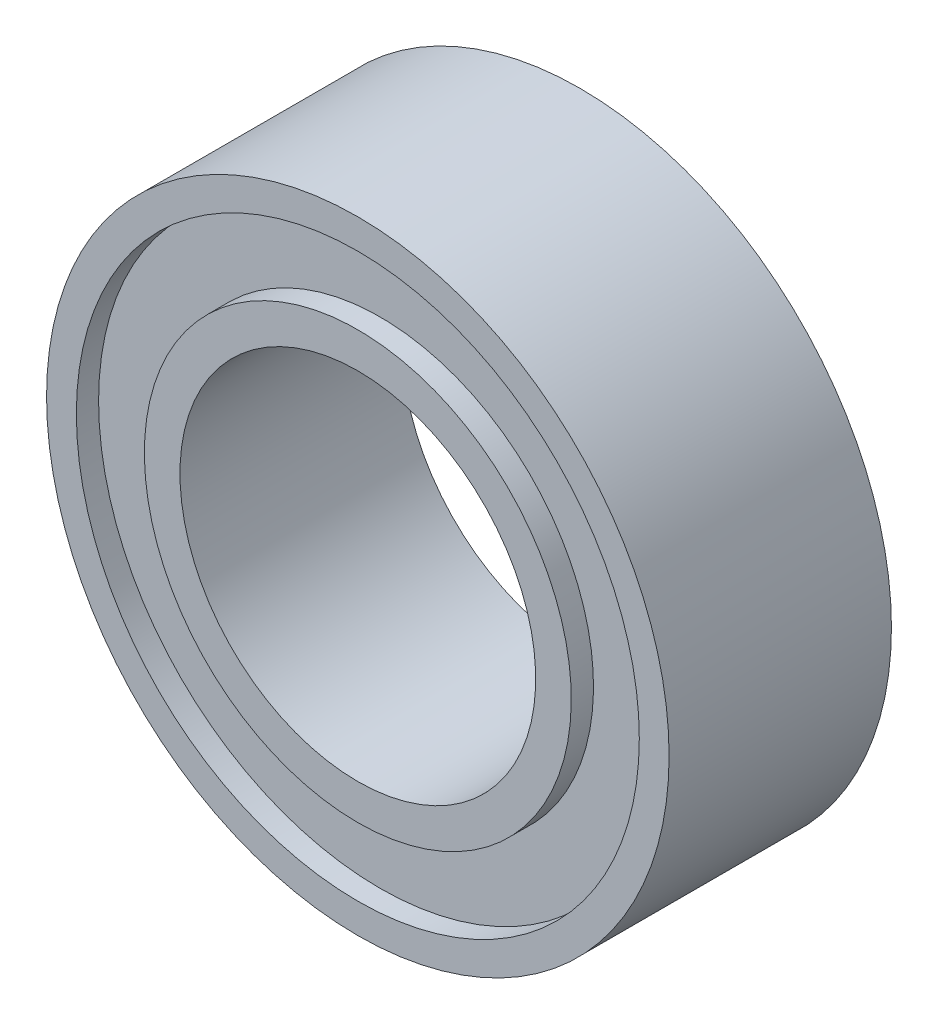
from build123d import *


with BuildPart() as part:
    # Sketch1 → Revolve1 (revolve)
    with BuildSketch(Plane(origin=(0, 0, 0), x_dir=(0, 0, -1), z_dir=(1, 0, 0)), mode=Mode.PRIVATE) as revolve1_sk:
        Polygon((-1.25, 3.5), (1.25, 3.5), (1.25, 3.165), (1, 3.165), (1, 2.4), (1.25, 2.4), (1.25, 2), (-1.25, 2), (-1.25, 2.4), (-1, 2.4), (-1, 3.165), (-1.25, 3.165), align=None)
    revolve(revolve1_sk.sketch.rotate(Axis((0, 0, 1.25), (0, 0, -1)), 180), axis=Axis((0, 0, 1.25), (0, 0, -1)))


solid = part.part
